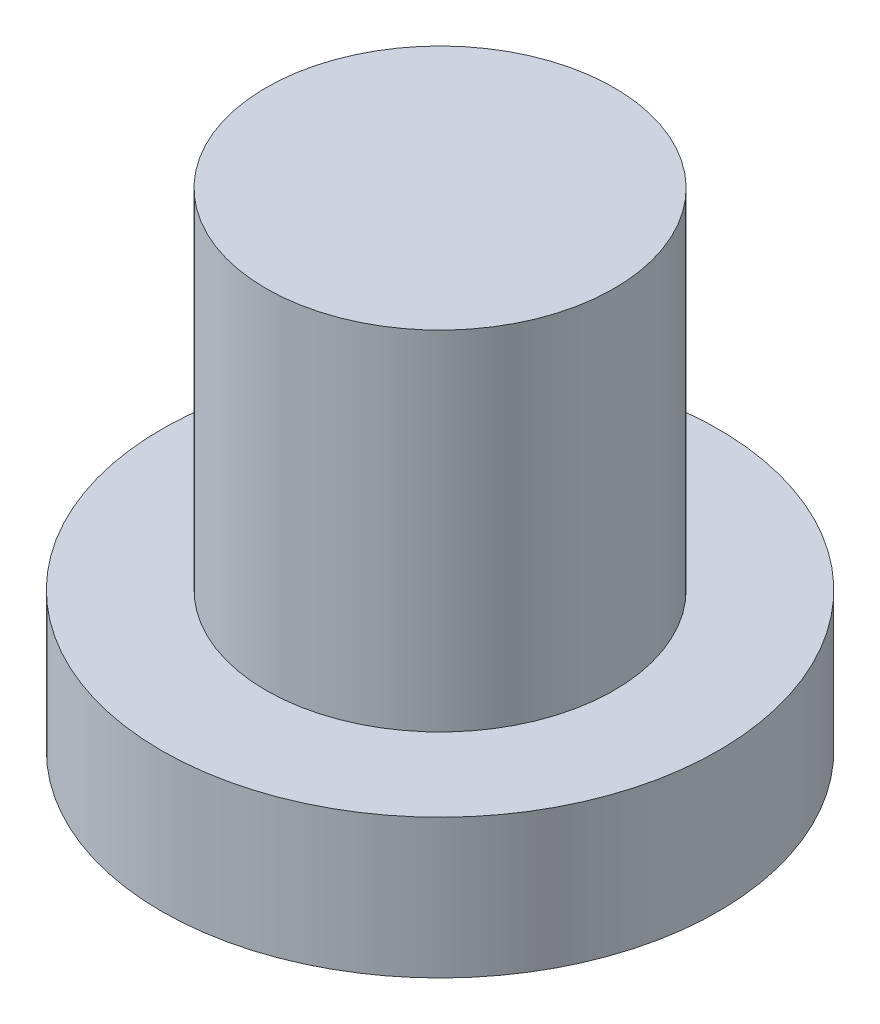
from build123d import *

# Parameters (mm, degrees)
SKETCH2_R           = 40
BOSS_EXTRUDE1_DEPTH = 20
SKETCH3_R           = 25
BOSS_EXTRUDE2_DEPTH = 50


with BuildPart() as part:
    # Sketch2 → Boss-Extrude1 (new body)
    with BuildSketch(Plane(origin=(0, 0, 0), x_dir=(1, 0, 0), z_dir=(0, 1, 0))):
        with Locations(Location((0, 0, 0), (0, 0, 270))):
            Circle(SKETCH2_R)
    extrude(amount=BOSS_EXTRUDE1_DEPTH)

    # Sketch3 → Boss-Extrude2 (add)
    with BuildSketch(Plane(origin=(0, 20, 0), x_dir=(1, 0, 0), z_dir=(0, 1, 0))):
        with Locations(Location((0, 0, 0), (0, 0, 270))):
            Circle(SKETCH3_R)
    extrude(amount=BOSS_EXTRUDE2_DEPTH)


solid = part.part
